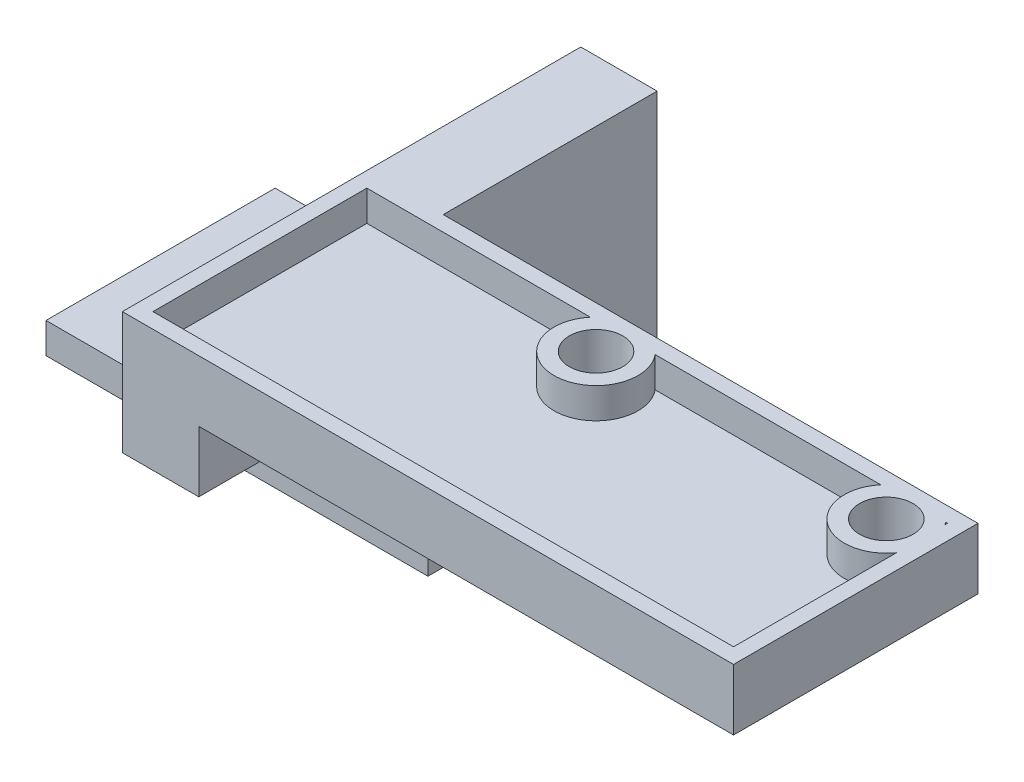
from build123d import *

# Parameters (mm, degrees)
SKETCH1_W           = 40
SKETCH1_H           = 16
BOSS_EXTRUDE1_DEPTH = 2
SKETCH2_W           = 40
SKETCH2_H           = 16
SKETCH2_W_2         = 38
SKETCH2_H_2         = 14
BOSS_EXTRUDE2_DEPTH = 2
BOSS_EXTRUDE5_REACH = 45.267
SKETCH3_R           = 2.75
SKETCH4_R           = 1.75
CUT_EXTRUDE1_DEPTH  = 44.266615306
SKETCH5_W           = 5
SKETCH5_H           = 16
BOSS_EXTRUDE6_DEPTH = 16
SKETCH6_W           = 20
SKETCH6_H           = 15
SKETCH6_R           = 2.6
BOSS_EXTRUDE7_DEPTH = 2
SKETCH7_W           = 5
SKETCH7_H           = 1
BOSS_EXTRUDE8_DEPTH = 2
SKETCH9_W           = 11.830057264
SKETCH9_H           = 8
CUT_EXTRUDE3_DEPTH  = 49.795491595
SKETCH10_W          = 5
SKETCH10_H          = 18
BOSS_EXTRUDE9_DEPTH = 14
SKETCH11_W          = 3.17
SKETCH11_H          = 8
CUT_EXTRUDE4_DEPTH  = 49.795491595


with BuildPart() as part:
    # Sketch1 → Boss-Extrude1 (new body)
    with BuildSketch(Plane(origin=(0, 0, 0), x_dir=(1, 0, 0), z_dir=(0, 1, 0))):
        with Locations((20, 8)):
            Rectangle(SKETCH1_W, SKETCH1_H)
    extrude(amount=BOSS_EXTRUDE1_DEPTH)

    # Sketch2 → Boss-Extrude2 (add)
    with BuildSketch(Plane(origin=(0, 2, 0), x_dir=(1, 0, 0), z_dir=(0, 1, 0))):
        with Locations((20, 8)):
            Rectangle(SKETCH2_W, SKETCH2_H)
        with Locations((20, 8)):
            Rectangle(SKETCH2_W_2, SKETCH2_H_2, mode=Mode.SUBTRACT)
    extrude(amount=BOSS_EXTRUDE2_DEPTH)

    # Sketch3 → Boss-Extrude5 (add, up to next)
    with BuildSketch(Plane(origin=(0, 4, 0), x_dir=(1, 0, 0), z_dir=(0, 1, 0)), mode=Mode.PRIVATE) as boss_extrude5_sk1:
        with Locations((17.75, 13.25)):
            Circle(SKETCH3_R)
    boss_extrude5_tool1 = extrude(boss_extrude5_sk1.sketch, amount=-BOSS_EXTRUDE5_REACH, mode=Mode.PRIVATE) - part.part
    # Sketch3 → Boss-Extrude5 (add, up to next)
    with BuildSketch(Plane(origin=(0, 4, 0), x_dir=(1, 0, 0), z_dir=(0, 1, 0)), mode=Mode.PRIVATE) as boss_extrude5_sk2:
        with Locations((36.75, 13.25)):
            Circle(SKETCH3_R)
    boss_extrude5_tool2 = extrude(boss_extrude5_sk2.sketch, amount=-BOSS_EXTRUDE5_REACH, mode=Mode.PRIVATE) - part.part
    add(boss_extrude5_tool1.solids().sort_by_distance((17.75, 4, -13.25))[0])
    add(boss_extrude5_tool2.solids().sort_by_distance((36.75, 4, -13.25))[0])

    # Sketch4 → Cut-Extrude1 (cut, through all)
    with BuildSketch(Plane(origin=(0, 4, 0), x_dir=(1, 0, 0), z_dir=(0, 1, 0))):
        with Locations(Location((17.75, 13.25, 0), (0, 0, 270))):
            Circle(SKETCH4_R)
        with Locations(Location((36.75, 13.25, 0), (0, 0, 270))):
            Circle(SKETCH4_R)
    extrude(amount=-CUT_EXTRUDE1_DEPTH, mode=Mode.SUBTRACT)

    # Sketch5 → Boss-Extrude6 (add)
    with BuildSketch(Plane(origin=(0, 0, 0), x_dir=(-1, 0, 0), z_dir=(0, -1, 0))):
        with Locations((-2.5, 8)):
            Rectangle(SKETCH5_W, SKETCH5_H)
    extrude(amount=BOSS_EXTRUDE6_DEPTH)

    # Sketch6 → Boss-Extrude7 (add)
    # profile 1 of 2: a face of its own
    with BuildSketch(Plane.XZ.offset(16)):
        Polygon((5, -30), (5, 0), (0, 0), (0, -15), (0, -30), align=None)
    # profile 2 of 2: a face of its own
    with BuildSketch(Plane.XZ.offset(16)):
        with Locations((-10, -22.5)):
            Rectangle(SKETCH6_W, SKETCH6_H)
        with Locations(Location((-10, -22.5, 0), (0, 0, 270))):
            Circle(SKETCH6_R, mode=Mode.SUBTRACT)
    extrude(amount=-BOSS_EXTRUDE7_DEPTH)

    # Sketch7 → Boss-Extrude8 (add)
    with BuildSketch(Plane(origin=(0, -14, 0), x_dir=(1, 0, 0), z_dir=(0, 1, 0))):
        with Locations((2.5, 15.5)):
            Rectangle(SKETCH7_W, SKETCH7_H)
    extrude(amount=BOSS_EXTRUDE8_DEPTH)

    # Sketch9 → Cut-Extrude3 (cut, through all)
    with BuildSketch(Plane(origin=(5, 0, 0), x_dir=(0, 0, -1), z_dir=(1, 0, 0))):
        with Locations((5.915028632, -12)):
            Rectangle(SKETCH9_W, SKETCH9_H)
    extrude(amount=-CUT_EXTRUDE3_DEPTH, mode=Mode.SUBTRACT)

    # Sketch10 → Boss-Extrude9 (add)
    with BuildSketch(Plane(origin=(0, 0, -16), x_dir=(-1, 0, 0), z_dir=(0, 0, -1))):
        with Locations((-2.5, -5)):
            Rectangle(SKETCH10_W, SKETCH10_H)
    extrude(amount=BOSS_EXTRUDE9_DEPTH)

    # Sketch11 → Cut-Extrude4 (cut, through all)
    with BuildSketch(Plane(origin=(5, 0, 0), x_dir=(0, 0, -1), z_dir=(1, 0, 0))):
        Polygon((0, -8), (11.830057264, -8), (15.000057264, -8), (15.000057264, -4), (0, -4), align=None)
        with Locations((13.415057264, -12)):
            Rectangle(SKETCH11_W, SKETCH11_H)
    extrude(amount=-CUT_EXTRUDE4_DEPTH, mode=Mode.SUBTRACT)


solid = part.part
